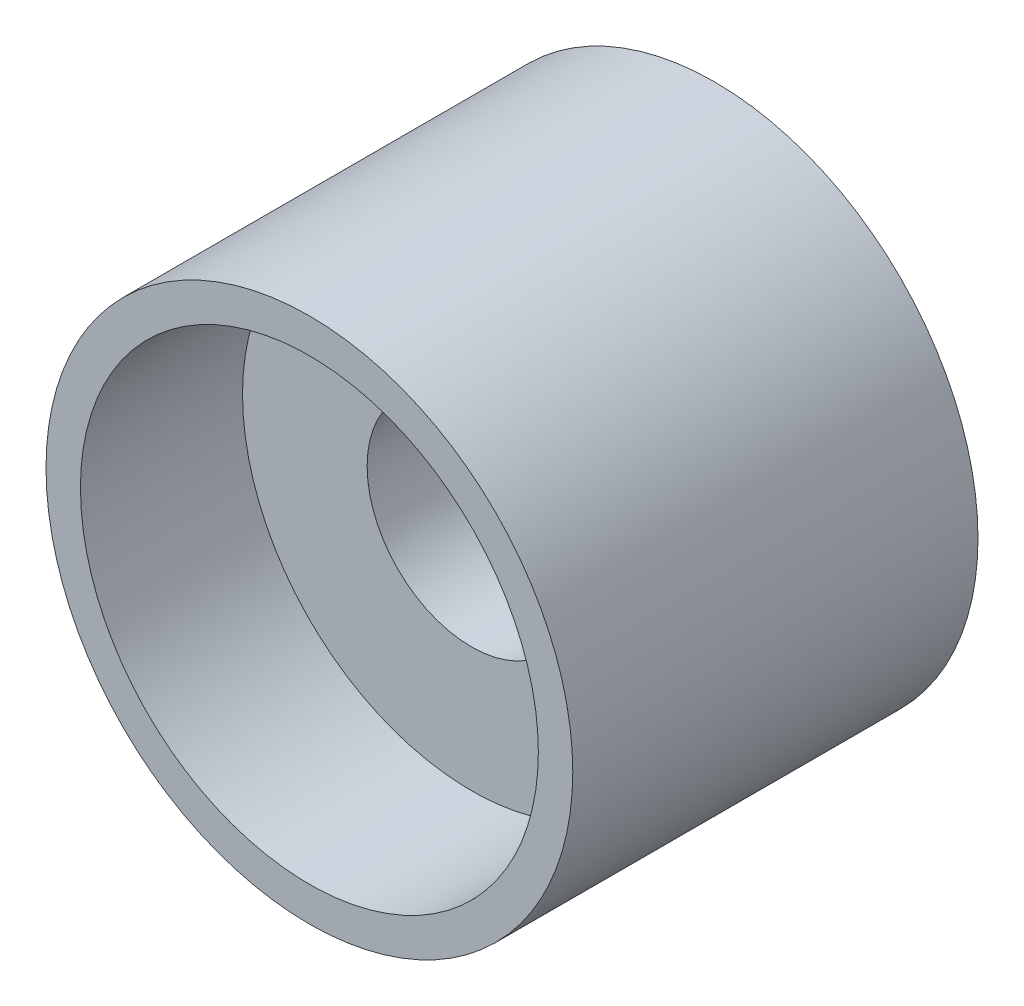
from build123d import *

# Parameters (mm, degrees)
SKETCH1_R           = 13
SKETCH1_R_2         = 5.15
BOSS_EXTRUDE1_DEPTH = 20
SKETCH2_R           = 11.3
CUT_EXTRUDE1_DEPTH  = 8


with BuildPart() as part:
    # Sketch1 → Boss-Extrude1 (new body)
    with BuildSketch(Plane.XY):
        Circle(SKETCH1_R)
        Circle(SKETCH1_R_2, mode=Mode.SUBTRACT)
    extrude(amount=BOSS_EXTRUDE1_DEPTH)

    # Sketch2 → Cut-Extrude1 (cut)
    with BuildSketch(Plane.XY.offset(20)):
        Circle(SKETCH2_R)
    extrude(amount=-CUT_EXTRUDE1_DEPTH, mode=Mode.SUBTRACT)


solid = part.part
